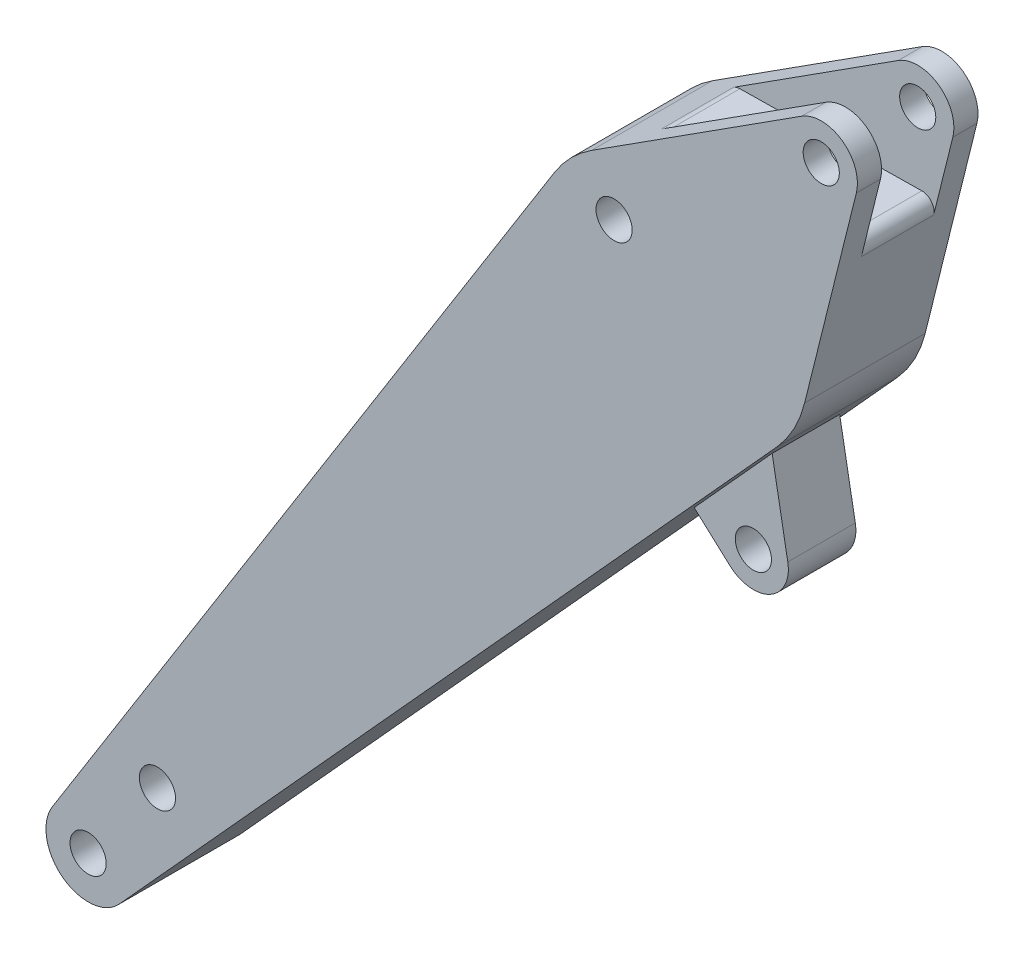
from build123d import *

# Parameters (mm, degrees)
EXTRUDE_1_DEPTH          = 5
EXTRUDE_1_DEPTH_BACK     = 5
SKETCH_1_R               = 1.5
CUT_EXTRUDE_1_DEPTH      = 3
CUT_EXTRUDE_1_DEPTH_BACK = 3
SKETCH_2_R               = 1.5
EXTRUDE_4_DEPTH          = 2.8
EXTRUDE_4_DEPTH_BACK     = 2.8
SKETCH_3_R               = 1.5
FILLET_1_R               = 10
FILLET_2_R               = 1


with BuildPart() as part:
    # 草图1 → 凸台-拉伸1 (new, two sides: drawn at the far end of the back side and taken through both)
    with BuildSketch(Plane.XY.offset(-EXTRUDE_1_DEPTH_BACK)):
        with BuildLine():
            Line((255.314096956, 96.605744176), (199.091935004, 34.648006604))
            ThreePointArc((199.091935004, 34.648006604), (194.385791324, 34.210713053), (193.535103741, 38.859943595))
            Line((193.535103741, 38.859943595), (236.376857538, 107.153065983))
            Line((236.376857538, 107.153065983), (255.681175992, 119.525749162))
            ThreePointArc((255.681175992, 119.525749162), (259.048997407, 119.43741832), (260.211134207, 116.275225808))
            Line((260.211134207, 116.275225808), (255.314096956, 96.605744176))
        make_face()
        with Locations((196.5, 37)):
            Circle(SKETCH_1_R, mode=Mode.SUBTRACT)
        with Locations((202.248291042, 44.563540844)):
            Circle(SKETCH_1_R, mode=Mode.SUBTRACT)
        with Locations((257.3, 117)):
            Circle(SKETCH_1_R, mode=Mode.SUBTRACT)
        with Locations((240.118819851, 104.309174626)):
            Circle(SKETCH_1_R, mode=Mode.SUBTRACT)
    extrude(amount=EXTRUDE_1_DEPTH + EXTRUDE_1_DEPTH_BACK)

    # 草图2 → 切除-拉伸1 (cut, two sides: drawn at the far end of the back side and taken through both)
    with BuildSketch(Plane.XY.offset(-CUT_EXTRUDE_1_DEPTH_BACK)):
        with BuildLine():
            Line((255.681175992, 119.525749162), (242.27027225, 110.930322002))
            Line((242.27027225, 110.930322002), (258.937967915, 111.161415211))
            Line((258.937967915, 111.161415211), (260.211134207, 116.275225808))
            ThreePointArc((260.211134207, 116.275225808), (259.048997407, 119.43741832), (255.681175992, 119.525749162))
        make_face()
        with Locations((257.3, 117)):
            Circle(SKETCH_2_R, mode=Mode.SUBTRACT)
    extrude(amount=CUT_EXTRUDE_1_DEPTH + CUT_EXTRUDE_1_DEPTH_BACK, mode=Mode.SUBTRACT)

    # 草图3 → 凸台-拉伸4 (add, two sides: drawn at the far end of the back side and taken through both)
    with BuildSketch(Plane.XY.offset(-EXTRUDE_4_DEPTH_BACK)):
        with BuildLine():
            Line((244.560105761, 84.754670841), (247.522317194, 82.066678389))
            ThreePointArc((247.522317194, 82.066678389), (250.878196788, 81.678515203), (252.324623716, 84.731456021))
            Line((252.324623716, 84.731456021), (251.028481638, 91.882926341))
            Line((251.028481638, 91.882926341), (244.560105761, 84.754670841))
        make_face()
        with Locations((249.471111722, 84.214281678)):
            Circle(SKETCH_3_R, mode=Mode.SUBTRACT)
    extrude(amount=EXTRUDE_4_DEPTH + EXTRUDE_4_DEPTH_BACK)

    # 圆角1
    fillet_1_edges = [part.edges().sort_by_distance(p)[0] for p in [
        (255.314096956, 96.605744176, 0),
        (236.376857538, 107.153065983, 0),
    ]]
    fillet(fillet_1_edges, radius=FILLET_1_R)

    # 圆角2
    fillet_2_edges = [part.edges().sort_by_distance(p)[0] for p in [
        (258.937967915, 111.161415211, 0),
        (242.27027225, 110.930322002, 0),
    ]]
    fillet(fillet_2_edges, radius=FILLET_2_R)


solid = part.part
